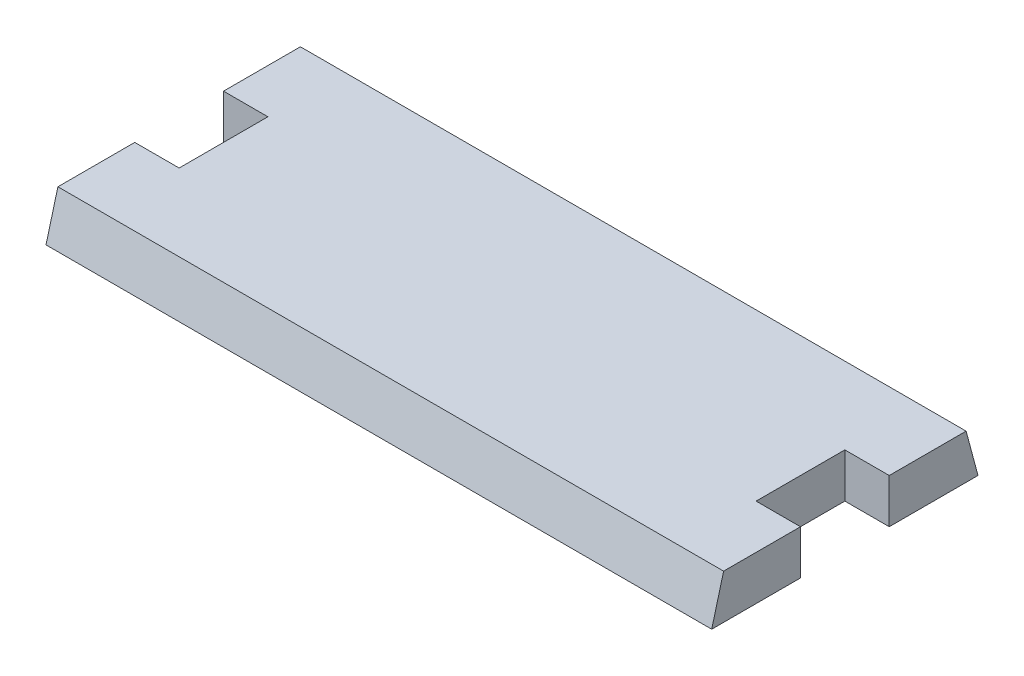
from build123d import *

# Parameters (mm, degrees)
BOSS_EXTRUDE1_DEPTH = 10
DRAFT1_ANGLE        = -15


with BuildPart() as part:
    # Sketch1 → Boss-Extrude1 (new body)
    with BuildSketch(Plane(origin=(0, 0, 0), x_dir=(1, 0, 0), z_dir=(0, 1, 0))):
        Polygon((-75, 30), (-75, 10), (-65, 10), (-65, -10), (-75, -10), (-75, -30), (75, -30), (75, -10), (65, -10), (65, 10), (75, 10), (75, 30), align=None)
    extrude(amount=BOSS_EXTRUDE1_DEPTH)

    # Draft1
    draft1_faces = [part.faces().sort_by_distance(p)[0] for p in [
        (0, 5, -30),
        (0, 5, 30),
    ]]
    draft(draft1_faces, Plane(origin=(0, 0, 0), x_dir=(0, 0, -1), z_dir=(0, -1, 0)), DRAFT1_ANGLE)


solid = part.part
